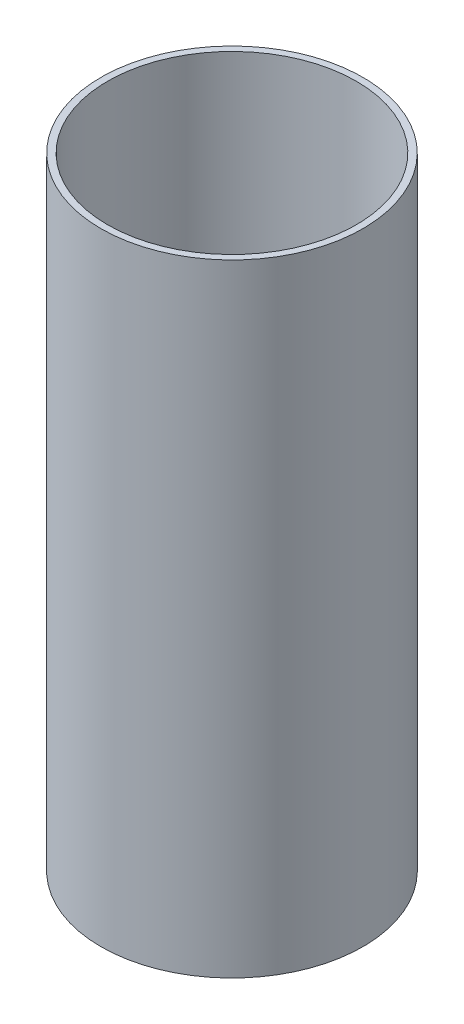
from build123d import *

# Parameters (mm, degrees)
SKETCH1_R           = 93.6625
SKETCH1_R_2         = 88.9
BOSS_EXTRUDE1_DEPTH = 222.25


with BuildPart() as part:
    # Sketch1 → Boss-Extrude1 (new, symmetric)
    with BuildSketch(Plane(origin=(0, 0, 0), x_dir=(1, 0, 0), z_dir=(0, 1, 0))):
        with Locations(Location((0, 0, 0), (0, 0, 270))):
            Circle(SKETCH1_R)
        with Locations(Location((0, 0, 0), (0, 0, 270))):
            Circle(SKETCH1_R_2, mode=Mode.SUBTRACT)
    extrude(amount=BOSS_EXTRUDE1_DEPTH, both=True)


solid = part.part
